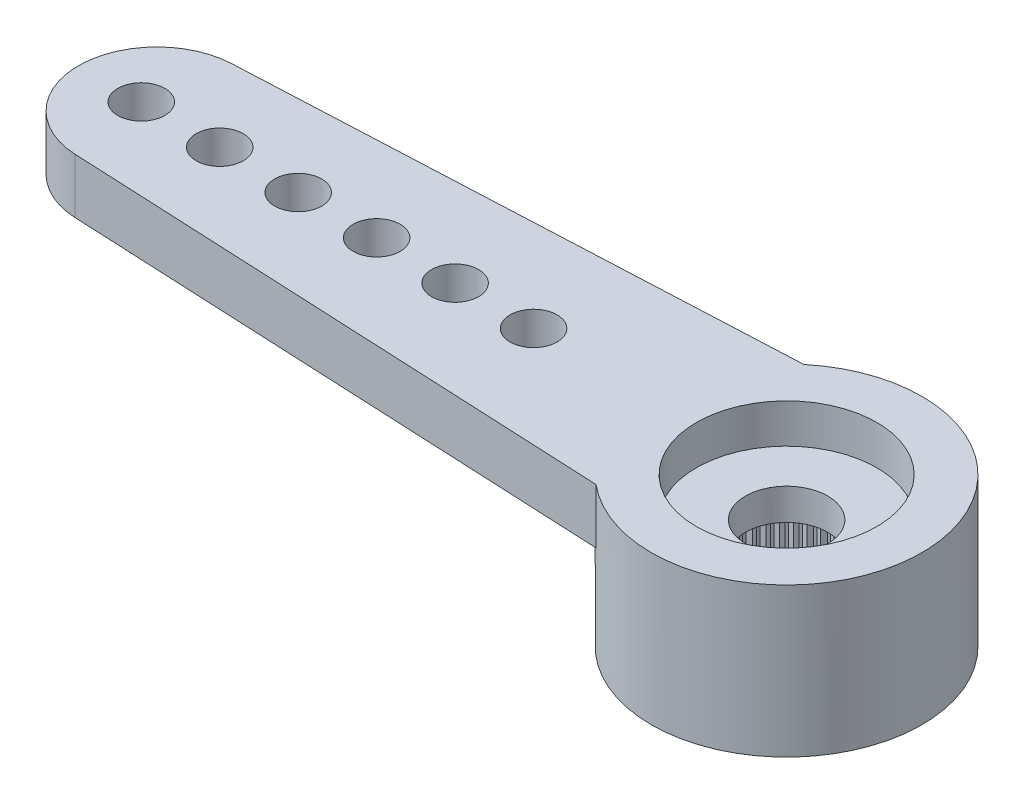
from build123d import *

# Parameters (mm, degrees)
RESSALTO_EXTRUS_O1_DEPTH = 1.4
ESBO_O2_R                = 3.45
RESSALTO_EXTRUS_O2_DEPTH = 2.4
FURO4_D                  = 1.2
PADR_O_LINEAR1_COUNT     = 6
PADR_O_LINEAR1_PITCH     = 2
FURO1_D                  = 4.95
FURO1_DEPTH              = 2
FURO2_D                  = 4.6
FURO2_DEPTH              = 1
FURO3_D                  = 2.1
RESSALTO_EXTRUS_O3_START = -2
RESSALTO_EXTRUS_O3_DEPTH = 2
PADR_OCIRCULAR1_COUNT    = 60


with BuildPart() as part:
    # Esboço1 → Ressalto-extrusão1 (new body)
    with BuildSketch(Plane(origin=(0, 0, 0), x_dir=(1, 0, 0), z_dir=(0, 1, 0))):
        with BuildLine():
            Line((-16.14350561, 1.997812979), (-2.209072203, 2.65))
            ThreePointArc((-2.209072203, 2.65), (3.45, 0), (-2.209072203, -2.65))
            Line((-2.209072203, -2.65), (-16.14350561, -1.997812979))
            ThreePointArc((-16.14350561, -1.997812979), (-18.05, 0), (-16.14350561, 1.997812979))
        make_face()
    extrude(amount=-RESSALTO_EXTRUS_O1_DEPTH)

    # Esboço2 → Ressalto-extrusão2 (add)
    with BuildSketch(Plane.XZ.offset(1.4)):
        with Locations(Location((0, 0, 0), (0, 0, 90))):
            Circle(ESBO_O2_R)
    extrude(amount=RESSALTO_EXTRUS_O2_DEPTH)

    # Furo4 (through all)
    with Locations(Plane(origin=(0, 0, 0), x_dir=(1, 0, 0), z_dir=(0, 1, 0))):
        with Locations((-16.45, 0)):
            furo4 = Hole(FURO4_D / 2)

    # Padrão linear1: Furo4 ×6
    with Locations(*[(i * PADR_O_LINEAR1_PITCH, 0, 0) for i in range(1, PADR_O_LINEAR1_COUNT)]):
        add(furo4, mode=Mode.SUBTRACT)

    # Furo1
    with Locations(Plane(origin=(0, -3.8, 0), x_dir=(-1, 0, 0), z_dir=(0, -1, 0))):
        with Locations((0, 0)):
            Hole(FURO1_D / 2, depth=FURO1_DEPTH)

    # Furo2
    with Locations(Plane(origin=(0, 0, 0), x_dir=(1, 0, 0), z_dir=(0, 1, 0))):
        with Locations((0, 0)):
            Hole(FURO2_D / 2, depth=FURO2_DEPTH)

    # Furo3 (through all)
    with Locations(Plane(origin=(0, 0, 0), x_dir=(1, 0, 0), z_dir=(0, 1, 0))):
        with Locations((0, 0)):
            Hole(FURO3_D / 2)

    # Esboço11 → Ressalto-extrusão3 (add)
    with BuildSketch(Plane.XZ.offset(3.8).offset(RESSALTO_EXTRUS_O3_START)):
        with BuildLine():
            Line((-0.098056786, 2.473056786), (0, 2.375))
            Line((0, 2.375), (0.098056786, 2.473056786))
            ThreePointArc((0.098056786, 2.473056786), (0, 2.475), (-0.098056786, 2.473056786))
        make_face()
    ressalto_extrus_o3 = extrude(amount=RESSALTO_EXTRUS_O3_DEPTH)

    # PadrãoCircular1: Ressalto-extrusão3 ×60 about axis
    padr_ocircular1_axis = Axis((0, 0, 0), (0, 1, 0))
    for i in range(1, PADR_OCIRCULAR1_COUNT):
        add(ressalto_extrus_o3.rotate(padr_ocircular1_axis, i * 360 / PADR_OCIRCULAR1_COUNT))


solid = part.part
